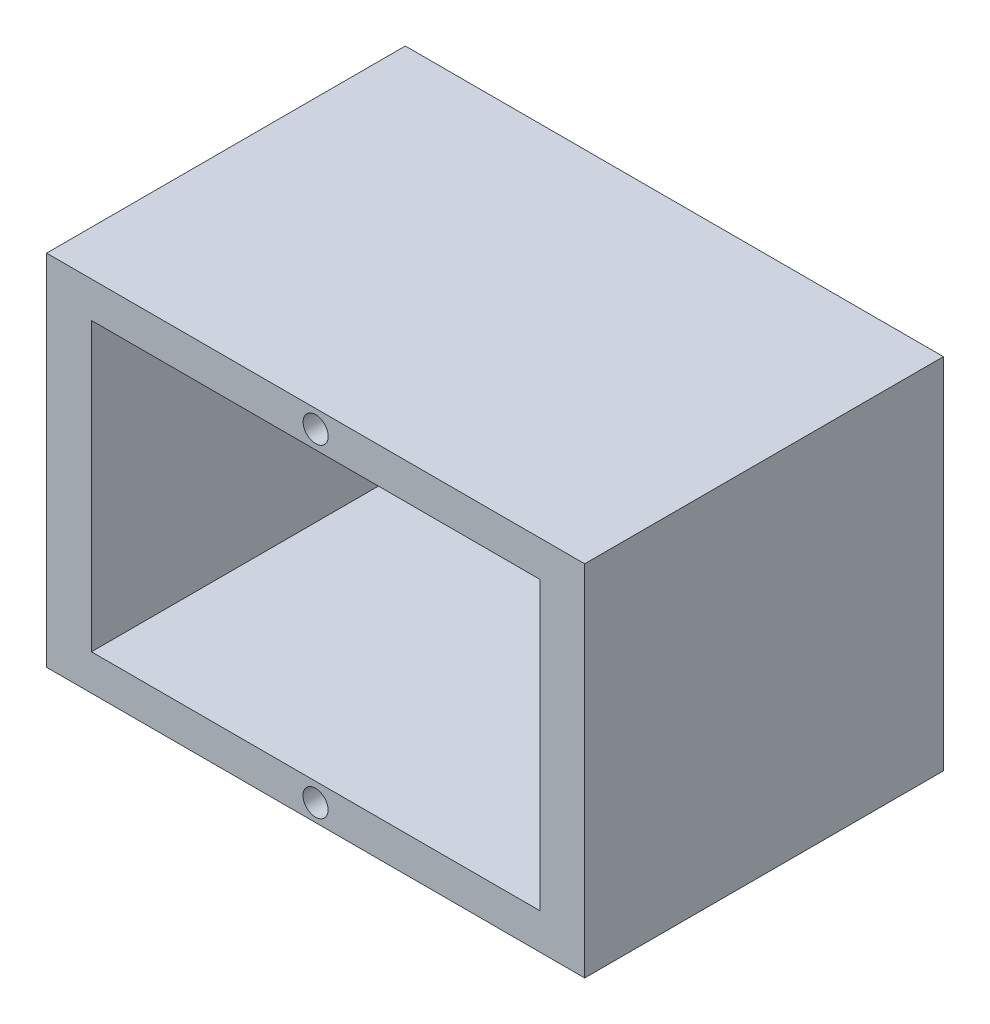
from build123d import *

# Parameters (mm, degrees)
SKETCH9_W           = 76.2
SKETCH9_H           = 50.8
BOSS_EXTRUDE2_DEPTH = 50.8
SKETCH10_W          = 63.5
SKETCH10_H          = 20.32
CUT_EXTRUDE3_DEPTH  = 40.64
SKETCH11_R          = 1.5875
SKETCH11_R_2        = 3.175
CUT_EXTRUDE4_DEPTH  = 90.976761381
SKETCH12_R          = 1.778
CUT_EXTRUDE5_DEPTH  = 12.7
SKETCH19_R          = 1.778
CUT_EXTRUDE9_DEPTH  = 12.7


with BuildPart() as part:
    # Sketch9 → Boss-Extrude2 (new body)
    with BuildSketch(Plane.XY):
        with Locations((30.646725964, -16.049917464)):
            Rectangle(SKETCH9_W, SKETCH9_H)
    extrude(amount=BOSS_EXTRUDE2_DEPTH)

    # Sketch10 → Cut-Extrude3 (cut)
    with BuildSketch(Plane.XY.offset(50.8)):
        with Locations((30.646725964, -5.889917464)):
            Rectangle(SKETCH10_W, SKETCH10_H)
        with Locations((30.646725964, -26.209917464)):
            Rectangle(SKETCH10_W, SKETCH10_H)
    extrude(amount=-CUT_EXTRUDE3_DEPTH, mode=Mode.SUBTRACT)

    # Sketch11 → Cut-Extrude4 (cut, through all)
    with BuildSketch(Plane.XY.offset(10.16)):
        with Locations((15.566258562, -14.584417496)):
            Circle(SKETCH11_R)
        with Locations((32.076258562, -14.584417496)):
            Circle(SKETCH11_R_2)
    extrude(amount=-CUT_EXTRUDE4_DEPTH, mode=Mode.SUBTRACT)

    # Sketch12 → Cut-Extrude5 (cut)
    with BuildSketch(Plane.XY.offset(50.8)):
        with Locations((30.646725964, 6.810082536)):
            Circle(SKETCH12_R)
    extrude(amount=-CUT_EXTRUDE5_DEPTH, mode=Mode.SUBTRACT)

    # Sketch19 → Cut-Extrude9 (cut)
    with BuildSketch(Plane.XY.offset(50.8)):
        with Locations((30.627843478, -39.011499114)):
            Circle(SKETCH19_R)
    extrude(amount=-CUT_EXTRUDE9_DEPTH, mode=Mode.SUBTRACT)


solid = part.part
